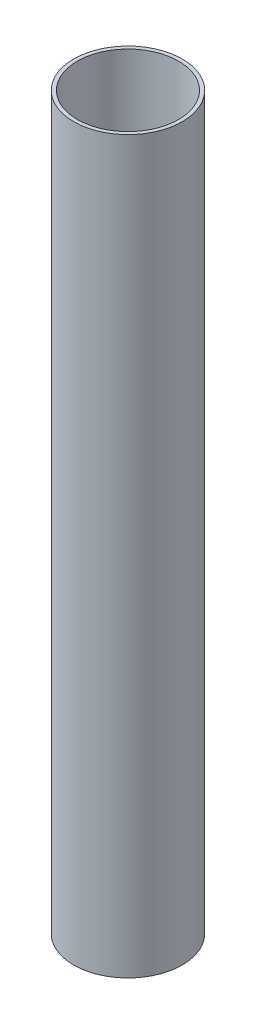
from build123d import *

# Parameters (mm, degrees)
SKETCH1_R           = 20.7645
SKETCH1_R_2         = 19.3675
BOSS_EXTRUDE1_DEPTH = 279.4


with BuildPart() as part:
    # Sketch1 → Boss-Extrude1 (new body)
    with BuildSketch(Plane(origin=(0, 0, 0), x_dir=(1, 0, 0), z_dir=(0, 1, 0))):
        with Locations(Location((0, 0, 0), (0, 0, 270))):
            Circle(SKETCH1_R)
        with Locations(Location((0, 0, 0), (0, 0, 270))):
            Circle(SKETCH1_R_2, mode=Mode.SUBTRACT)
    extrude(amount=BOSS_EXTRUDE1_DEPTH)


solid = part.part
